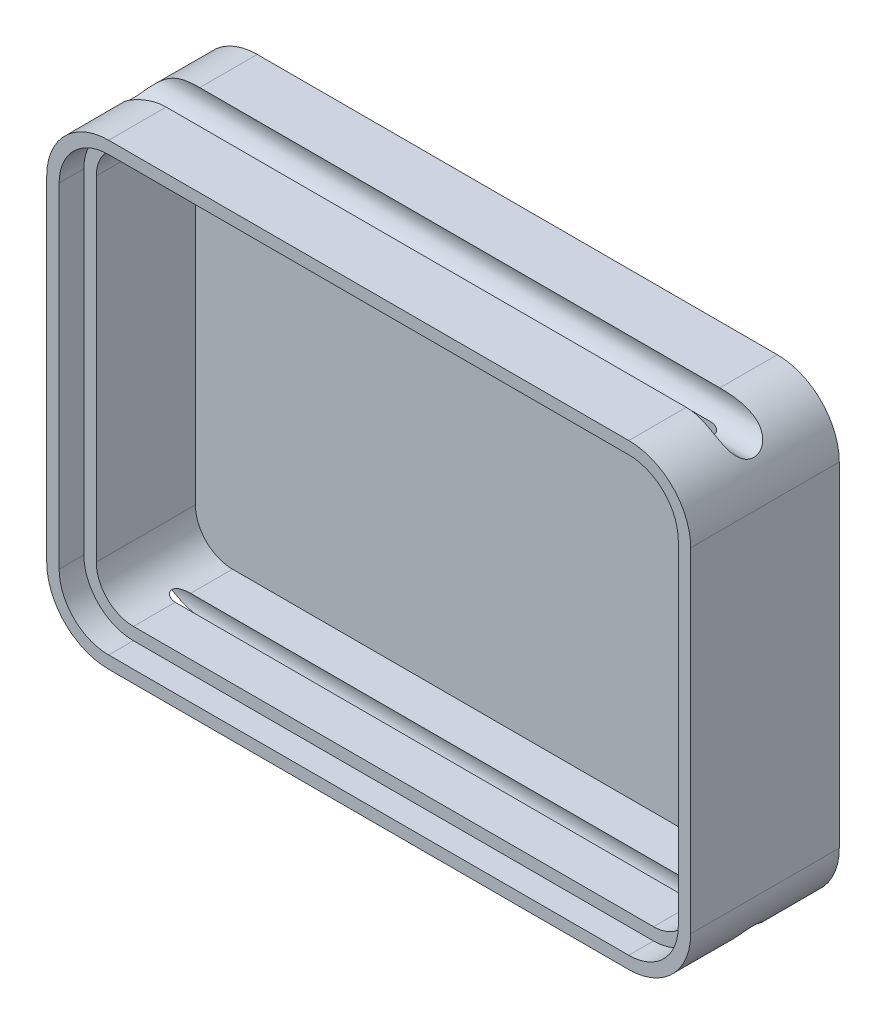
from build123d import *

# Parameters (mm, degrees)
BOSS_EXTRU_1_DEPTH      = 12
COQUE5_T                = -2
ENL_V_MAT_EXTRU_1_DEPTH = 2
ESQUISSE7_R             = 1.5
ENL_V_MAT_EXTRU_2_DEPTH = 65.93843238
ESQUISSE8_R             = 1.5
ENL_V_MAT_EXTRU_3_DEPTH = 65.938432536


with BuildPart() as part:
    # Esquisse1 → Boss.-Extru.1 (new body)
    with BuildSketch(Plane.XY):
        with BuildLine():
            Line((5, 0), (47, 0))
            ThreePointArc((47, 0), (50.535533906, 1.464466094), (52, 5))
            Line((52, 5), (52, 32))
            ThreePointArc((52, 32), (50.535533906, 35.535533906), (47, 37))
            Line((47, 37), (5, 37))
            ThreePointArc((5, 37), (1.464466094, 35.535533906), (0, 32))
            Line((0, 32), (0, 5))
            ThreePointArc((0, 5), (1.464466094, 1.464466094), (5, 0))
        make_face()
    extrude(amount=BOSS_EXTRU_1_DEPTH)

    # Coque5
    coque5_openings = [part.faces().sort_by_distance(p)[0] for p in [
        (26, 18.5, 12),
    ]]
    offset(amount=COQUE5_T, openings=coque5_openings, kind=Kind.INTERSECTION)

    # Esquisse3 → Enlèv. mat.-Extru.1 (cut)
    with BuildSketch(Plane.XY.offset(12)):
        with BuildLine():
            ThreePointArc((51, 32), (49.828427125, 34.828427125), (47, 36))
            Line((47, 36), (5, 36))
            ThreePointArc((5, 36), (2.171572875, 34.828427125), (1, 32))
            Line((1, 32), (1, 5))
            ThreePointArc((1, 5), (2.171572875, 2.171572875), (5, 1))
            Line((5, 1), (47, 1))
            ThreePointArc((47, 1), (49.828427125, 2.171572875), (51, 5))
            Line((51, 5), (51, 32))
        make_face()
    extrude(amount=-ENL_V_MAT_EXTRU_1_DEPTH, mode=Mode.SUBTRACT)

    # Esquisse7 → Enlèv. mat.-Extru.2 (cut, through all)
    with BuildSketch(Plane(origin=(52, 0, 0), x_dir=(0, 0, -1), z_dir=(1, 0, 0))):
        with Locations((-6, 36.365)):
            Circle(ESQUISSE7_R)
    extrude(amount=-ENL_V_MAT_EXTRU_2_DEPTH, mode=Mode.SUBTRACT)

    # Esquisse8 → Enlèv. mat.-Extru.3 (cut, through all)
    with BuildSketch(Plane(origin=(52, 0, 0), x_dir=(0, 0, -1), z_dir=(1, 0, 0))):
        with Locations((-6, 0.635)):
            Circle(ESQUISSE8_R)
    extrude(amount=-ENL_V_MAT_EXTRU_3_DEPTH, mode=Mode.SUBTRACT)


solid = part.part
